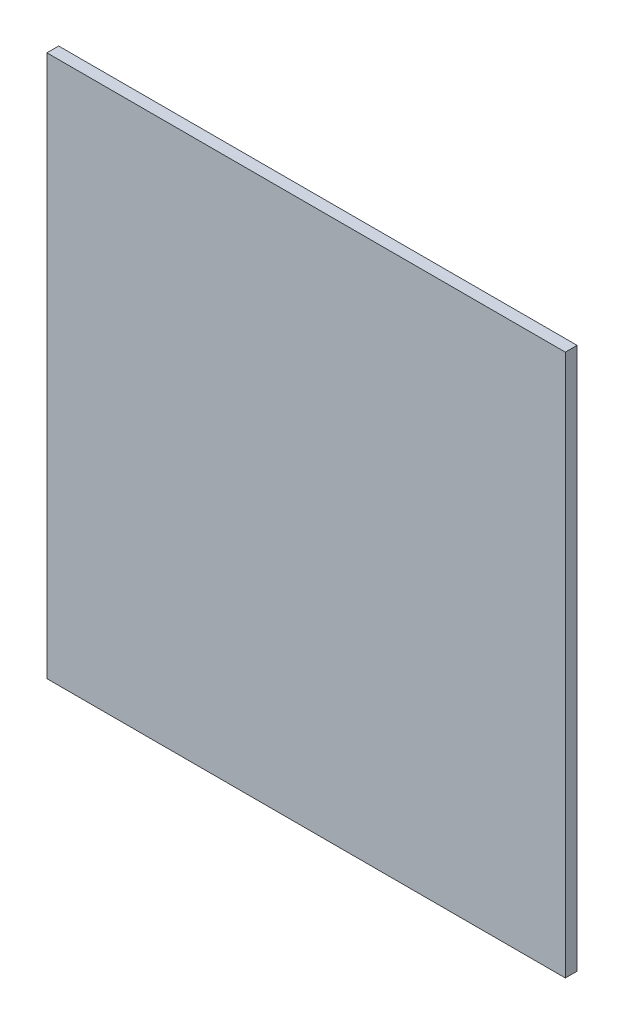
from build123d import *

# Parameters (mm, degrees)
SKETCH1_W           = 558.8
SKETCH1_H           = 584.2
BOSS_EXTRUDE1_DEPTH = 12.7


with BuildPart() as part:
    # Sketch1 → Boss-Extrude1 (new body)
    with BuildSketch(Plane.XY):
        with Locations((279.4, 292.1)):
            Rectangle(SKETCH1_W, SKETCH1_H)
    extrude(amount=BOSS_EXTRUDE1_DEPTH)


solid = part.part
